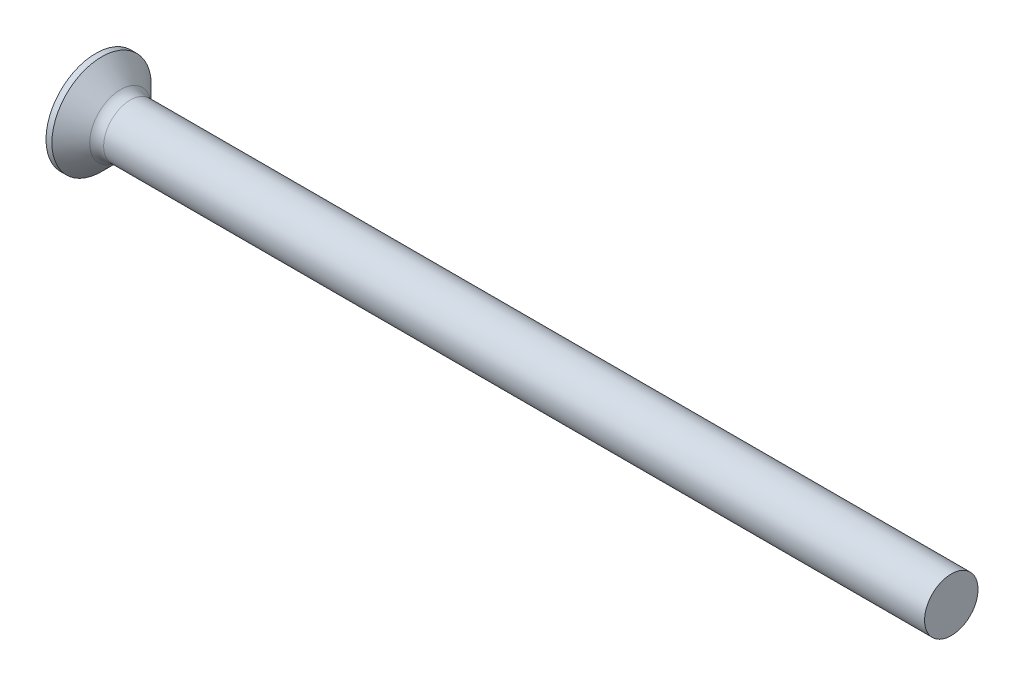
from build123d import *

# Parameters (mm, degrees)
FILLET1_R    = 1.3
RECPAT_COUNT = 2
RECPAT_ANGLE = 90


with BuildPart() as part:
    # BodySke → Base-Revolve (revolve)
    with BuildSketch(Plane.XY, mode=Mode.PRIVATE) as base_revolve_sk:
        Polygon((0, 0), (0, 4.65), (0.55, 4.65), (2.7, 2.5), (80, 2.5), (80, 0), align=None)
    revolve(base_revolve_sk.sketch.rotate(Axis((-6.35, 0, 0), (1, 0, 0)), 90), axis=Axis((-6.35, 0, 0), (1, 0, 0)))

    # Fillet1
    fillet1_edges = [part.edges().sort_by_distance(p)[0] for p in [
        (2.7, 0, -2.5),
    ]]
    fillet(fillet1_edges, radius=FILLET1_R)

    # Sketch3 → Recess section 0
    with BuildSketch(Plane.ZY):
        with BuildLine():
            Line((-0.515, 2.45), (0.515, 2.45))
            Line((0.515, 2.45), (0.515, -2.45))
            Line((0.515, -2.45), (-0.515, -2.45))
            Line((-0.515, -2.45), (-0.515, 2.45))
        make_face()
    # Sketch4 → Recess section 1
    with BuildSketch(Plane.ZY.offset(-3.05)):
        with BuildLine():
            Line((-0.515, 0.92932635), (0.515, 0.92932635))
            Line((0.515, 0.92932635), (0.515, -0.92932635))
            Line((0.515, -0.92932635), (-0.515, -0.92932635))
            Line((-0.515, -0.92932635), (-0.515, 0.92932635))
        make_face()
    recess = loft(mode=Mode.SUBTRACT)

    # RecPat: Recess ×2 about axis
    recpat_axis = Axis((0, 0, 0), (1, 0, 0))
    for i in range(1, RECPAT_COUNT):
        add(recess.rotate(recpat_axis, i * RECPAT_ANGLE / (RECPAT_COUNT - 1)), mode=Mode.SUBTRACT)

    # RecCorSke → RecessCore (revolve, cut)
    with BuildSketch(Plane.XY, mode=Mode.PRIVATE) as recesscore_sk:
        Polygon((0, 0), (0, 1.064276776), (3.05, 0.851), (3.326506661, 0), align=None)
    revolve(recesscore_sk.sketch.rotate(Axis((-3.175, 0, 0), (1, 0, 0)), 90), axis=Axis((-3.175, 0, 0), (1, 0, 0)), mode=Mode.SUBTRACT)


solid = part.part
